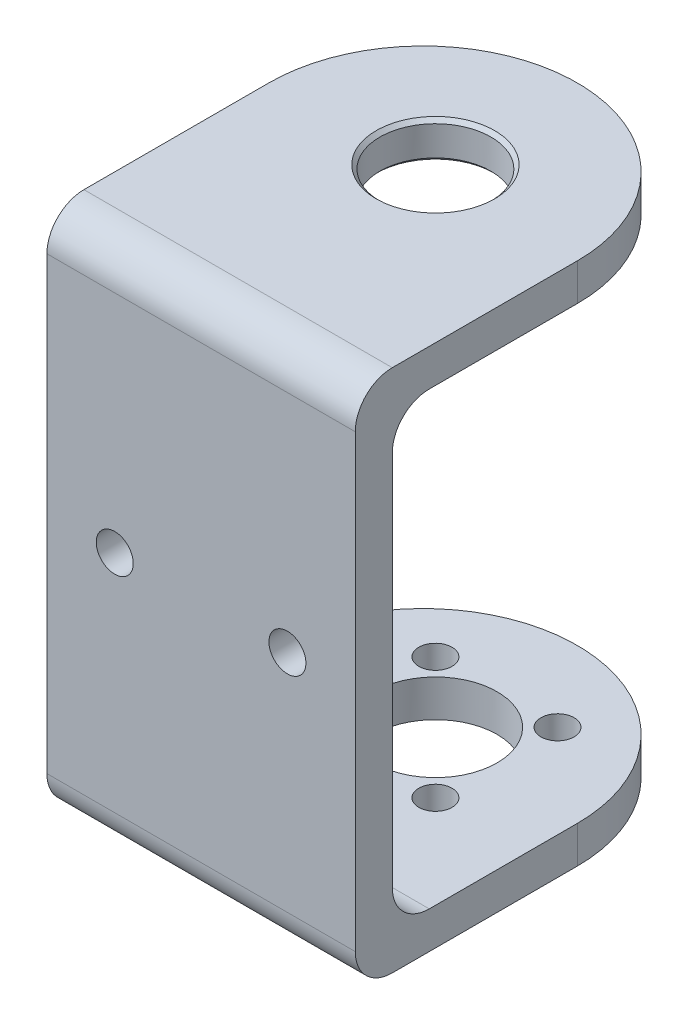
from build123d import *

# Parameters (mm, degrees)
BOSS_EXTRUDE3_DEPTH = 21.25
SHELL1_T            = -3
SKETCH6_R           = 4.5
CUT_EXTRUDE4_DEPTH  = 8.5
SKETCH8_R           = 1.347336496
CUT_EXTRUDE5_DEPTH  = 6
SKETCH9_R           = 1.5
CUT_EXTRUDE6_DEPTH  = 10
FILLET1_R           = 3
SKETCH11_R          = 5
CUT_EXTRUDE7_DEPTH  = 10
CHAMFER1_SIZE       = 0.3


with BuildPart() as part:
    # Sketch3 → Boss-Extrude3 (new, symmetric)
    with BuildSketch(Plane(origin=(0, 0, 0), x_dir=(1, 0, 0), z_dir=(0, 1, 0))):
        with BuildLine():
            Line((-12.5, 4), (12.5, 4))
            Line((12.5, 4), (12.5, 22))
            ThreePointArc((12.5, 22), (0, 34.5), (-12.5, 22))
            Line((-12.5, 22), (-12.5, 4))
        make_face()
    extrude(amount=BOSS_EXTRUDE3_DEPTH, both=True)

    # Shell1
    shell1_openings = [part.faces().sort_by_distance(p)[0] for p in [
        (0, 0, -34.5),
        (12.5, 0, -13),
        (-12.5, 0, -13),
    ]]
    offset(amount=SHELL1_T, openings=shell1_openings, kind=Kind.INTERSECTION)

    # Sketch6 → Cut-Extrude4 (cut)
    with BuildSketch(Plane(origin=(0, 21.25, 0), x_dir=(1, 0, 0), z_dir=(0, 1, 0))):
        with Locations(Location((0, 23, 0), (0, 0, 270))):
            Circle(SKETCH6_R)
    extrude(amount=-CUT_EXTRUDE4_DEPTH, mode=Mode.SUBTRACT)

    # Sketch8 → Cut-Extrude5 (cut)
    with BuildSketch(Plane(origin=(0, -21.25, 0), x_dir=(-1, 0, 0), z_dir=(0, -1, 0))):
        with Locations(Location((4.949747468, 18.050252532, 0), (0, 0, 90))):
            Circle(SKETCH8_R)
        with Locations(Location((-4.949747468, 18.050252532, 0), (0, 0, 90))):
            Circle(SKETCH8_R)
        with Locations(Location((-4.949747468, 27.949747468, 0), (0, 0, 90))):
            Circle(SKETCH8_R)
        with Locations(Location((4.949747468, 27.949747468, 0), (0, 0, 90))):
            Circle(SKETCH8_R)
    extrude(amount=-CUT_EXTRUDE5_DEPTH, mode=Mode.SUBTRACT)

    # Sketch9 → Cut-Extrude6 (cut)
    with BuildSketch(Plane(origin=(0, 0, -7), x_dir=(-1, 0, 0), z_dir=(0, 0, -1))):
        with Locations((-7, 0)):
            Circle(SKETCH9_R)
        with Locations((7, 0)):
            Circle(SKETCH9_R)
    extrude(amount=-CUT_EXTRUDE6_DEPTH, mode=Mode.SUBTRACT)

    # Fillet1
    fillet1_edges = [part.edges().sort_by_distance(p)[0] for p in [
        (0, -18.25, -7),
        (0, 18.25, -7),
        (0, -21.25, -4),
        (0, 21.25, -4),
    ]]
    fillet(fillet1_edges, radius=FILLET1_R)

    # Sketch11 → Cut-Extrude7 (cut)
    with BuildSketch(Plane(origin=(0, -18.25, 0), x_dir=(1, 0, 0), z_dir=(0, 1, 0))):
        with Locations(Location((0, 23, 0), (0, 0, 270))):
            Circle(SKETCH11_R)
    extrude(amount=-CUT_EXTRUDE7_DEPTH, mode=Mode.SUBTRACT)

    # Chamfer1
    chamfer1_edges = [part.edges().sort_by_distance(p)[0] for p in [
        (0, 18.25, -27.5),
        (0, 21.25, -27.5),
    ]]
    chamfer(chamfer1_edges, length=CHAMFER1_SIZE)


solid = part.part
